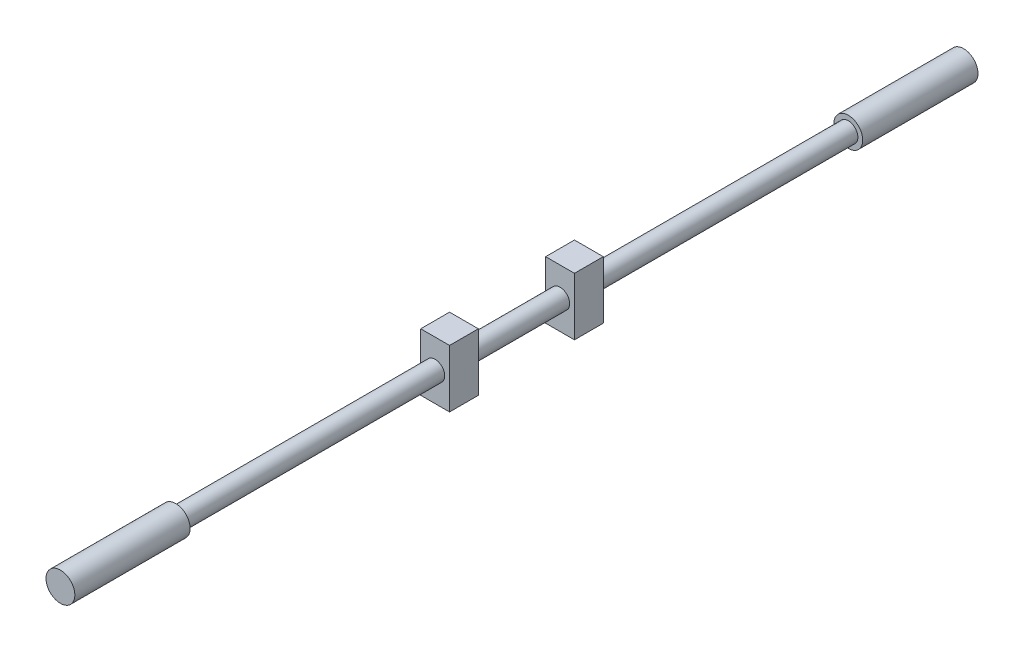
from build123d import *

# Parameters (mm, degrees)
SKETCH1_R           = 25.4
BOSS_EXTRUDE1_DEPTH = 1778
SKETCH2_R           = 38.1
BOSS_EXTRUDE2_DEPTH = 304.8
BOSS_EXTRUDE3_START = 304.8
SKETCH3_R           = 38.1
BOSS_EXTRUDE3_DEPTH = 304.8
SKETCH4_W           = 76.2
SKETCH4_H           = 76.2
BOSS_EXTRUDE4_DEPTH = 76.2


with BuildPart() as part:
    # Sketch1 → Boss-Extrude1 (new body)
    with BuildSketch(Plane.XY):
        Circle(SKETCH1_R)
    extrude(amount=BOSS_EXTRUDE1_DEPTH)

    # Sketch2 → Boss-Extrude2 (add)
    with BuildSketch(Plane.XY.offset(1778)):
        with Locations(Location((0, 0, 0), (0, 0, 180))):
            Circle(SKETCH2_R)
    extrude(amount=BOSS_EXTRUDE2_DEPTH)

    # Sketch3 → Boss-Extrude3 (add)
    with BuildSketch(Plane(origin=(0, 0, 0), x_dir=(-1, 0, 0), z_dir=(0, 0, -1)).offset(BOSS_EXTRUDE3_START)):
        Circle(SKETCH3_R)
    extrude(amount=-BOSS_EXTRUDE3_DEPTH)

    # Sketch4 → Boss-Extrude4 (add, symmetric)
    with BuildSketch(Plane(origin=(0, 0, 0), x_dir=(1, 0, 0), z_dir=(0, 1, 0))):
        with Locations((0, -1054.1)):
            Rectangle(SKETCH4_W, SKETCH4_H)
        with Locations((0, -723.9)):
            Rectangle(SKETCH4_W, SKETCH4_H)
    extrude(amount=BOSS_EXTRUDE4_DEPTH, both=True)


solid = part.part
